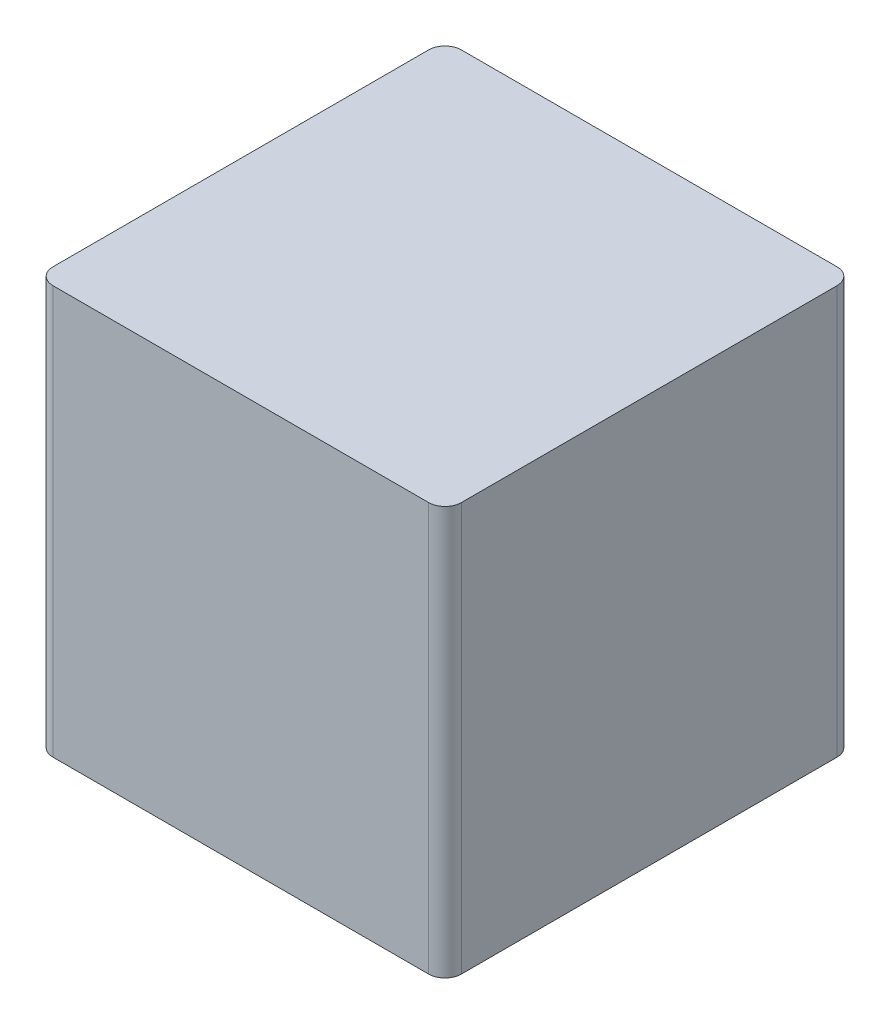
from build123d import *

# Parameters (mm, degrees)
SKETCH1_W           = 63.5
SKETCH1_H           = 63.5
BOSS_EXTRUDE1_DEPTH = 63.5
FILLET1_R           = 2.54


with BuildPart() as part:
    # Sketch1 → Boss-Extrude1 (new body)
    with BuildSketch(Plane(origin=(0, 0, 0), x_dir=(1, 0, 0), z_dir=(0, 1, 0))):
        Rectangle(SKETCH1_W, SKETCH1_H)
    extrude(amount=BOSS_EXTRUDE1_DEPTH)

    # Fillet1
    fillet1_edges = [part.edges().sort_by_distance(p)[0] for p in [
        (31.75, 31.75, 31.75),
        (31.75, 31.75, -31.75),
        (-31.75, 31.75, -31.75),
        (-31.75, 31.75, 31.75),
    ]]
    fillet(fillet1_edges, radius=FILLET1_R)


solid = part.part
